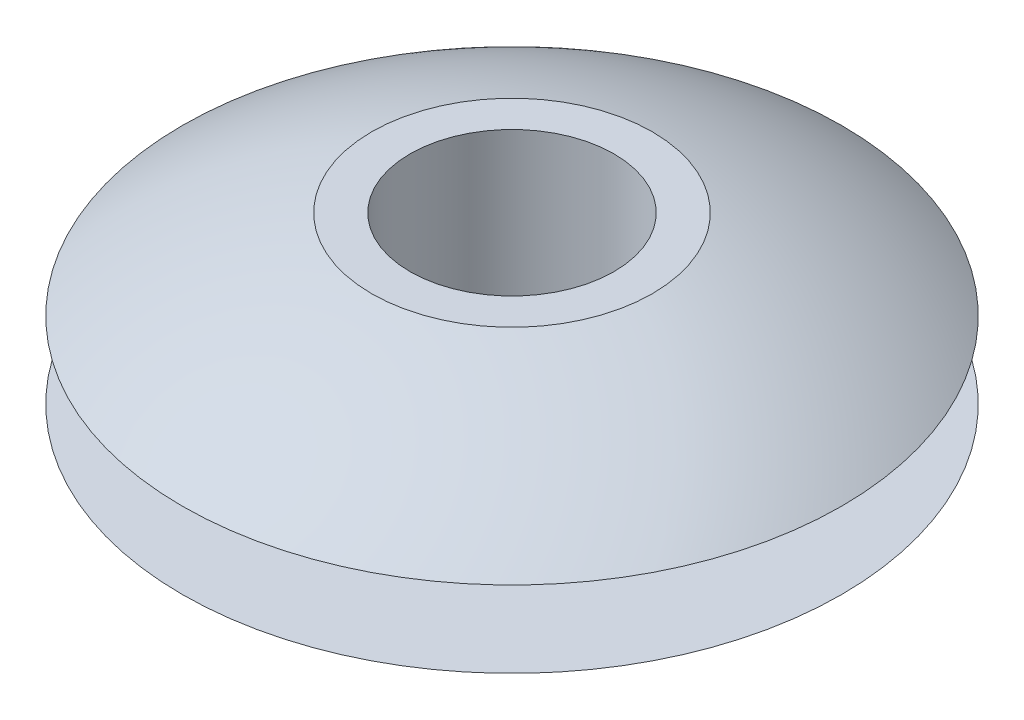
from build123d import *


with BuildPart() as part:
    # 草图2 → 旋转1 (revolve)
    with BuildSketch(Plane(origin=(0, 0, 0), x_dir=(0, 0, -1), z_dir=(1, 0, 0))):
        with BuildLine():
            Line((6.463548925, 0.75), (2.75, 0.75))
            Line((2.75, 0.75), (2.75, -0.75))
            Line((2.75, -0.75), (6.463548925, -0.75))
            ThreePointArc((6.463548925, -0.75), (4.689135949, -1.799773377), (2.75, -2.5))
            Line((2.75, -2.5), (2, -2.5))
            Line((2, -2.5), (2, 2.5))
            Line((2, 2.5), (2.75, 2.5))
            ThreePointArc((2.75, 2.5), (4.689135949, 1.799773377), (6.463548925, 0.75))
        make_face()
    revolve(axis=Axis((0, 32.338552752, 0), (0, -1, 0)))


solid = part.part
